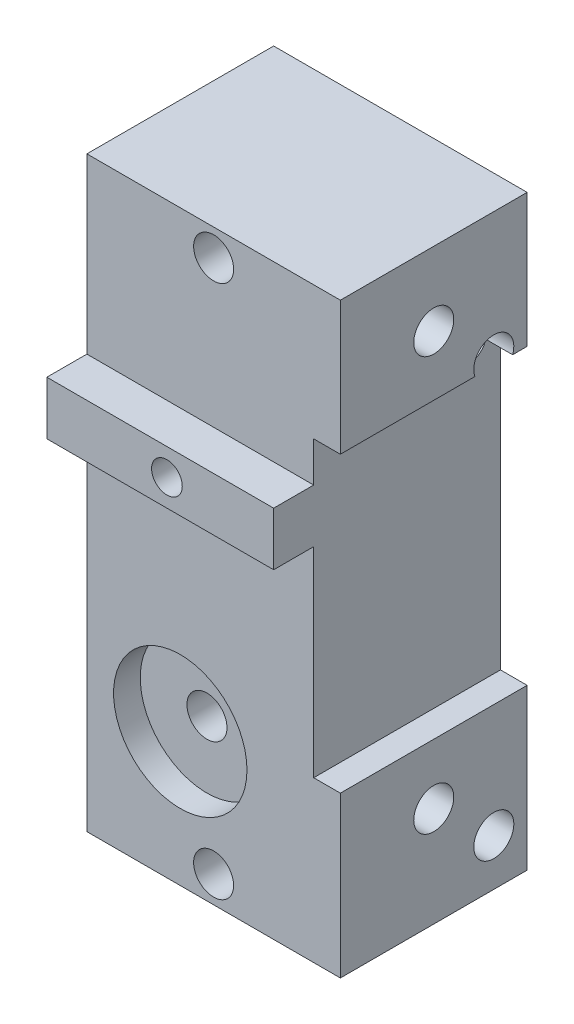
from build123d import *

# Parameters (mm, degrees)
SKETCH1_W               = 19
SKETCH1_H               = 44
BOSS_EXTRUDE1_DEPTH     = 14
CUT_EXTRUDE1_DEPTH      = 48.140746706
CUT_EXTRUDE1_DEPTH_BACK = 48.140746706
SKETCH2_R               = 1.5
CUT_EXTRUDE2_START      = -9.5
SKETCH3_R               = 1.5
CUT_EXTRUDE2_DEPTH      = 20
BOSS_EXTRUDE2_START     = 14
SKETCH4_W               = 19
SKETCH4_H               = 4
BOSS_EXTRUDE2_DEPTH     = 3
CUT_EXTRUDE3_START      = 17
SKETCH5_R               = 1.15
CUT_EXTRUDE3_DEPTH      = 7.5
SKETCH6_R               = 3
CUT_EXTRUDE4_DEPTH      = 9.5
CUT_EXTRUDE5_DEPTH      = 49.117044817
CUT_EXTRUDE5_DEPTH_BACK = 49.117044817
SKETCH8_R               = 1.5
CUT_EXTRUDE6_DEPTH      = 36
SKETCH9_R               = 5
CUT_EXTRUDE7_DEPTH      = 2


with BuildPart() as part:
    # Sketch1 → Boss-Extrude1 (new body)
    with BuildSketch(Plane.XY):
        with Locations((0, 22)):
            Rectangle(SKETCH1_W, SKETCH1_H)
    extrude(amount=BOSS_EXTRUDE1_DEPTH)

    # Sketch2 → Cut-Extrude1 (cut, two sides: drawn at the far end of the back side and taken through both)
    with BuildSketch(Plane.XY.offset(-CUT_EXTRUDE1_DEPTH_BACK)):
        with Locations((0, 2)):
            Circle(SKETCH2_R)
        with Locations((0, 42)):
            Circle(SKETCH2_R)
    extrude(amount=CUT_EXTRUDE1_DEPTH + CUT_EXTRUDE1_DEPTH_BACK, mode=Mode.SUBTRACT)

    # Sketch3 → Cut-Extrude2 (cut)
    with BuildSketch(Plane(origin=(0, 0, 0), x_dir=(0, 0, -1), z_dir=(1, 0, 0)).offset(CUT_EXTRUDE2_START)):
        with Locations(Location((-7, 7.5, 0), (0, 0, 180))):
            Circle(SKETCH3_R)
        with Locations(Location((-7, 38.5, 0), (0, 0, 180))):
            Circle(SKETCH3_R)
        with Locations(Location((-2.5, 3.5, 0), (0, 0, 180))):
            Circle(SKETCH3_R)
        with Locations(Location((-2.5, 34.5, 0), (0, 0, 180))):
            Circle(SKETCH3_R)
    extrude(amount=CUT_EXTRUDE2_DEPTH, mode=Mode.SUBTRACT)

    # Sketch4 → Boss-Extrude2 (add)
    with BuildSketch(Plane.XY.offset(BOSS_EXTRUDE2_START)):
        with Locations((0, 29)):
            Rectangle(SKETCH4_W, SKETCH4_H)
    extrude(amount=BOSS_EXTRUDE2_DEPTH)

    # Sketch5 → Cut-Extrude3 (cut)
    with BuildSketch(Plane.XY.offset(CUT_EXTRUDE3_START)):
        with Locations((-0.5, 29)):
            Circle(SKETCH5_R)
    extrude(amount=-CUT_EXTRUDE3_DEPTH, mode=Mode.SUBTRACT)

    # Sketch6 → Cut-Extrude4 (cut)
    with BuildSketch(Plane.XY):
        with Locations((-0.5, 29)):
            Circle(SKETCH6_R)
    extrude(amount=CUT_EXTRUDE4_DEPTH, mode=Mode.SUBTRACT)

    # Sketch7 → Cut-Extrude5 (cut, two sides: drawn at the far end of the back side and taken through both)
    with BuildSketch(Plane.XY.offset(-CUT_EXTRUDE5_DEPTH_BACK)):
        Polygon((97.397368474, 34), (9.5, 34), (7.5, 34), (7.5, 12), (9.5, 12), (97.397368474, 12), (273.192105422, 12), (273.192105422, 34), align=None)
    extrude(amount=CUT_EXTRUDE5_DEPTH + CUT_EXTRUDE5_DEPTH_BACK, mode=Mode.SUBTRACT)

    # Sketch8 → Cut-Extrude6 (cut)
    with BuildSketch(Plane(origin=(0, 0, 0), x_dir=(-1, 0, 0), z_dir=(0, 0, -1))):
        with Locations((2.5, 10)):
            Circle(SKETCH8_R)
    extrude(amount=-CUT_EXTRUDE6_DEPTH, mode=Mode.SUBTRACT)

    # Sketch9 → Cut-Extrude7 (cut)
    with BuildSketch(Plane.XY.offset(14)):
        with Locations((-2.5, 10)):
            Circle(SKETCH9_R)
    extrude(amount=-CUT_EXTRUDE7_DEPTH, mode=Mode.SUBTRACT)


solid = part.part
